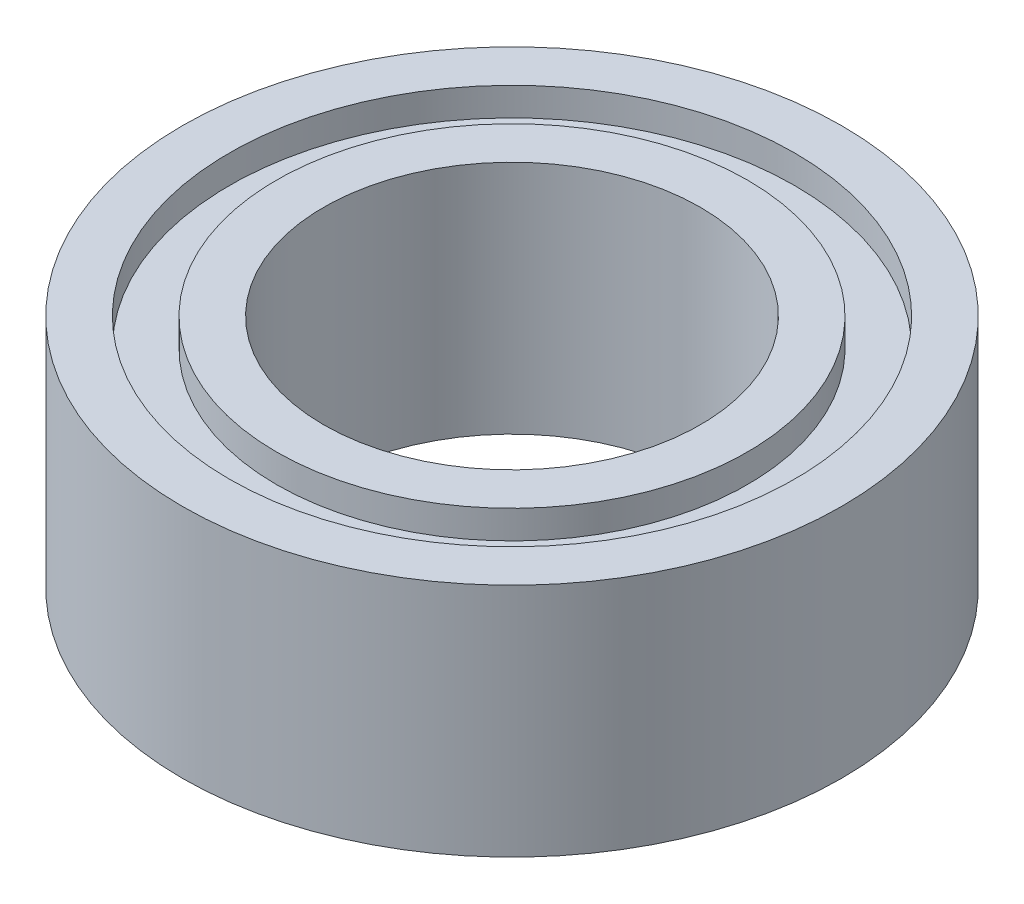
from build123d import *


with BuildPart() as part:
    # 草图1 → 旋转1 (revolve)
    with BuildSketch(Plane.XY, mode=Mode.PRIVATE) as revolve_1_sk:
        Polygon((2, 0), (2, 2.5), (2.5, 2.5), (2.5, 2.2), (3, 2.2), (3, 2.5), (3.5, 2.5), (3.5, 0), (3, 0), (3, 0.3), (2.5, 0.3), (2.5, 0), align=None)
    revolve(revolve_1_sk.sketch.rotate(Axis((0, 7.969031367, 0), (0, -1, 0)), 90), axis=Axis((0, 7.969031367, 0), (0, -1, 0)))


solid = part.part
